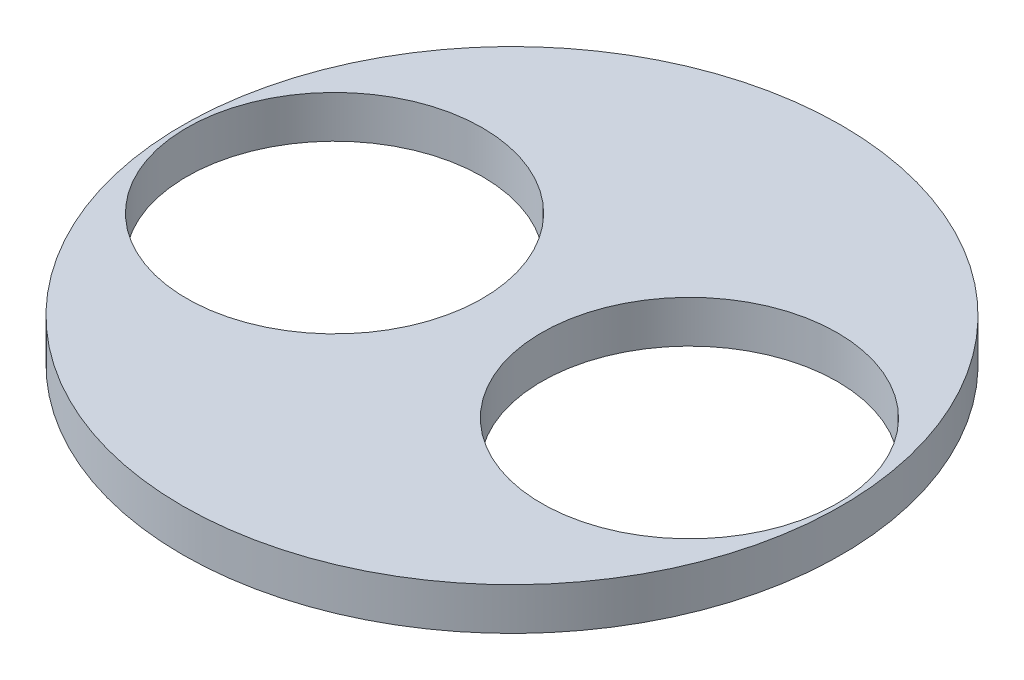
from build123d import *

# Parameters (mm, degrees)
SKETCH1_R           = 49.53
BOSS_EXTRUDE1_DEPTH = 6.35
SKETCH2_R           = 22.225
CUT_EXTRUDE1_DEPTH  = 71.33323752


with BuildPart() as part:
    # Sketch1 → Boss-Extrude1 (new body)
    with BuildSketch(Plane(origin=(0, 0, 0), x_dir=(1, 0, 0), z_dir=(0, 1, 0))):
        with Locations(Location((0, 0, 0), (0, 0, 270))):
            Circle(SKETCH1_R)
    extrude(amount=BOSS_EXTRUDE1_DEPTH)

    # Sketch2 → Cut-Extrude1 (cut, through all)
    with BuildSketch(Plane(origin=(0, 0, 0), x_dir=(-1, 0, 0), z_dir=(0, -1, 0))):
        with Locations(Location((26.67, 0, 0), (0, 0, 90))):
            Circle(SKETCH2_R)
        with Locations(Location((-26.67, 0, 0), (0, 0, 90))):
            Circle(SKETCH2_R)
    extrude(amount=-CUT_EXTRUDE1_DEPTH, mode=Mode.SUBTRACT)


solid = part.part
